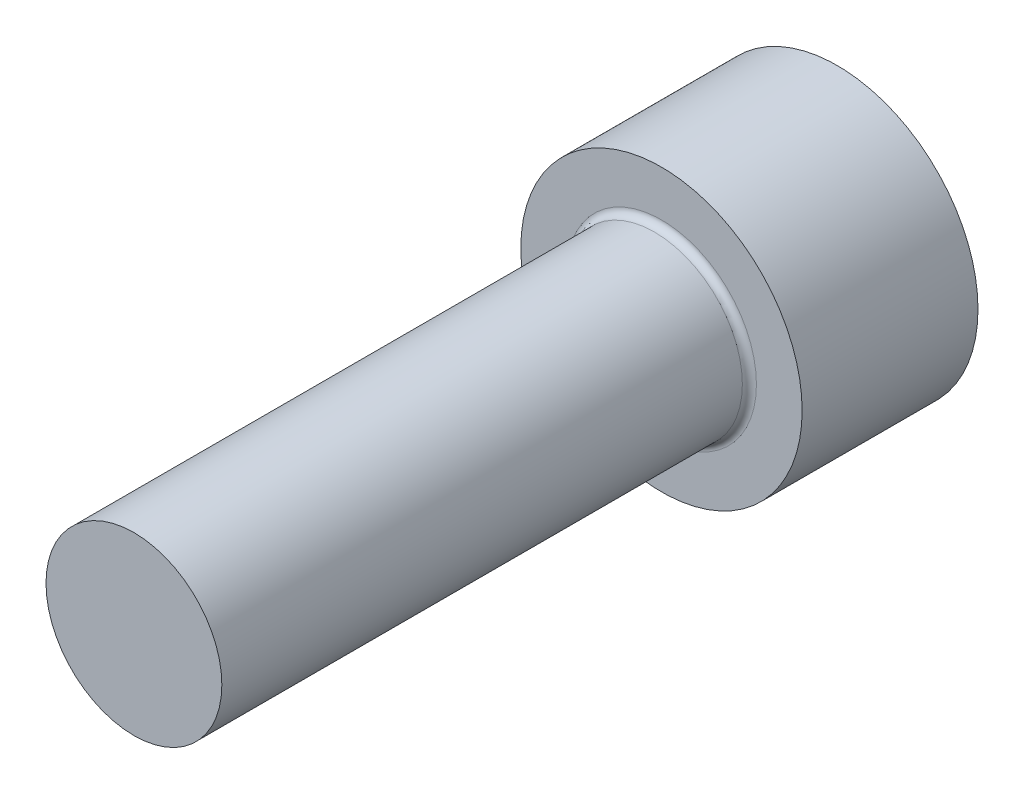
from build123d import *

# Parameters (mm, degrees)
SKETCH_1_R        = 4
EXTRUDE_235_DEPTH = 5
SKETCH_2_R        = 2.5
EXTRUDE_323_DEPTH = 15
FILLET_1_R        = 0.2


with BuildPart() as part:
    # 草图1 → Extrude 235 (new body)
    with BuildSketch(Plane.XY):
        Circle(SKETCH_1_R)
    extrude(amount=EXTRUDE_235_DEPTH)

    # 草图2 → Extrude 323 (add)
    with BuildSketch(Plane.XY.offset(5)):
        Circle(SKETCH_2_R)
    extrude(amount=EXTRUDE_323_DEPTH)

    # 圆角1
    fillet_1_edges = [part.edges().sort_by_distance(p)[0] for p in [
        (-2.5, 0, 5),
    ]]
    fillet(fillet_1_edges, radius=FILLET_1_R)


solid = part.part
